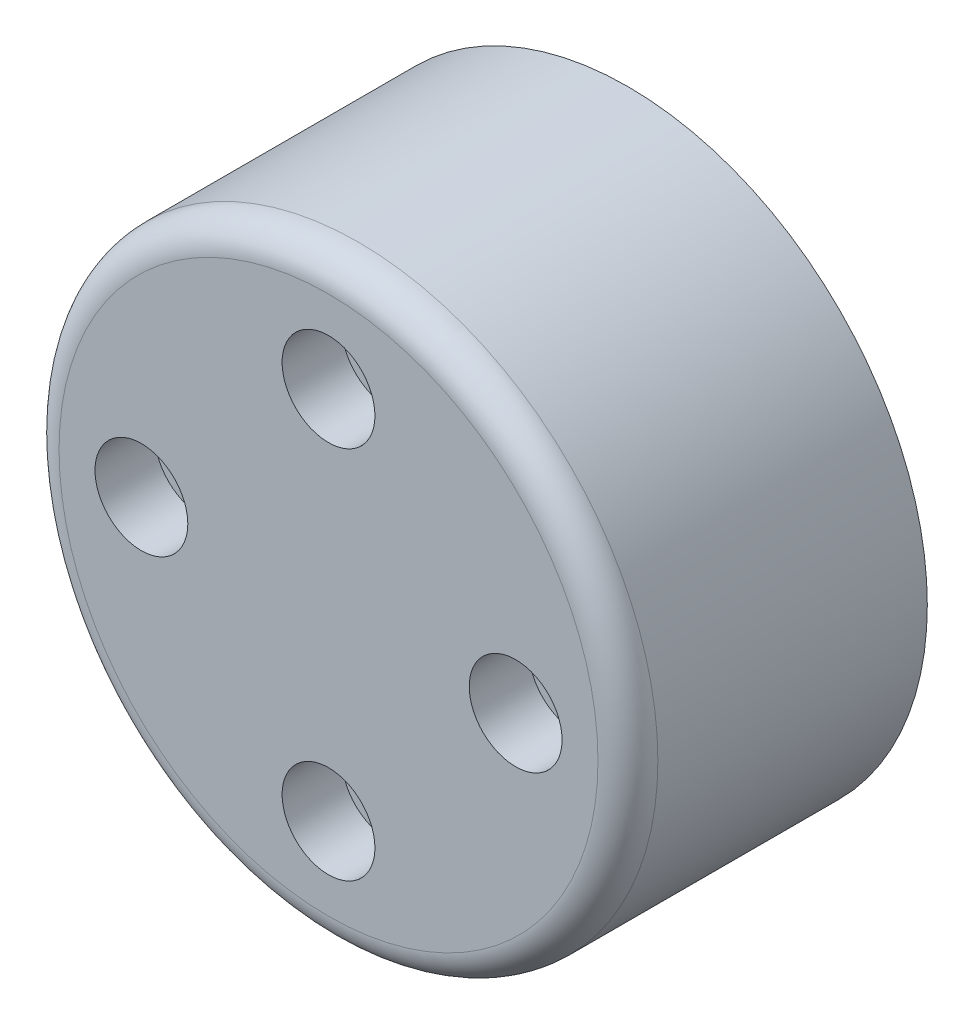
from build123d import *

# Parameters (mm, degrees)
SKETCH_1_R          = 20
SKETCH_1_R_2        = 1.6
EXTRUDE_1_DEPTH     = 20
SKETCH_2_R          = 3.1
CUT_EXTRUDE_1_DEPTH = 4
SKETCH_3_R          = 3.1
CUT_EXTRUDE_2_DEPTH = 5
FILLET_1_R          = 2


with BuildPart() as part:
    # 草图1 → 凸台-拉伸1 (new body)
    with BuildSketch(Plane.XY):
        Circle(SKETCH_1_R)
        with Locations((12.5, 0)):
            Circle(SKETCH_1_R_2, mode=Mode.SUBTRACT)
        with Locations((0, -12.5)):
            Circle(SKETCH_1_R_2, mode=Mode.SUBTRACT)
        with Locations(Location((-12.5, 0, 0), (0, 0, 180))):
            Circle(SKETCH_1_R_2, mode=Mode.SUBTRACT)
        with Locations(Location((0, 12.5, 0), (0, 0, 180))):
            Circle(SKETCH_1_R_2, mode=Mode.SUBTRACT)
    extrude(amount=EXTRUDE_1_DEPTH)

    # 草图2 → 切除-拉伸1 (cut)
    with BuildSketch(Plane.XY.offset(20)):
        with Locations((-12.5, 0)):
            Circle(SKETCH_2_R)
        with Locations((0, -12.5)):
            Circle(SKETCH_2_R)
        with Locations((12.5, 0)):
            Circle(SKETCH_2_R)
        with Locations((0, 12.5)):
            Circle(SKETCH_2_R)
    extrude(amount=-CUT_EXTRUDE_1_DEPTH, mode=Mode.SUBTRACT)

    # 草图3 → 切除-拉伸2 (cut)
    with BuildSketch(Plane(origin=(0, 0, 0), x_dir=(-1, 0, 0), z_dir=(0, 0, -1))):
        with Locations((-6.717514421, 6.717514421)):
            Circle(SKETCH_3_R)
        with Locations((6.717514421, 6.717514421)):
            Circle(SKETCH_3_R)
        with Locations((6.717514421, -6.717514421)):
            Circle(SKETCH_3_R)
        with Locations((-6.717514421, -6.717514421)):
            Circle(SKETCH_3_R)
    extrude(amount=-CUT_EXTRUDE_2_DEPTH, mode=Mode.SUBTRACT)

    # 圆角1
    fillet_1_edges = [part.edges().sort_by_distance(p)[0] for p in [
        (-20, 0, 20),
    ]]
    fillet(fillet_1_edges, radius=FILLET_1_R)


solid = part.part
